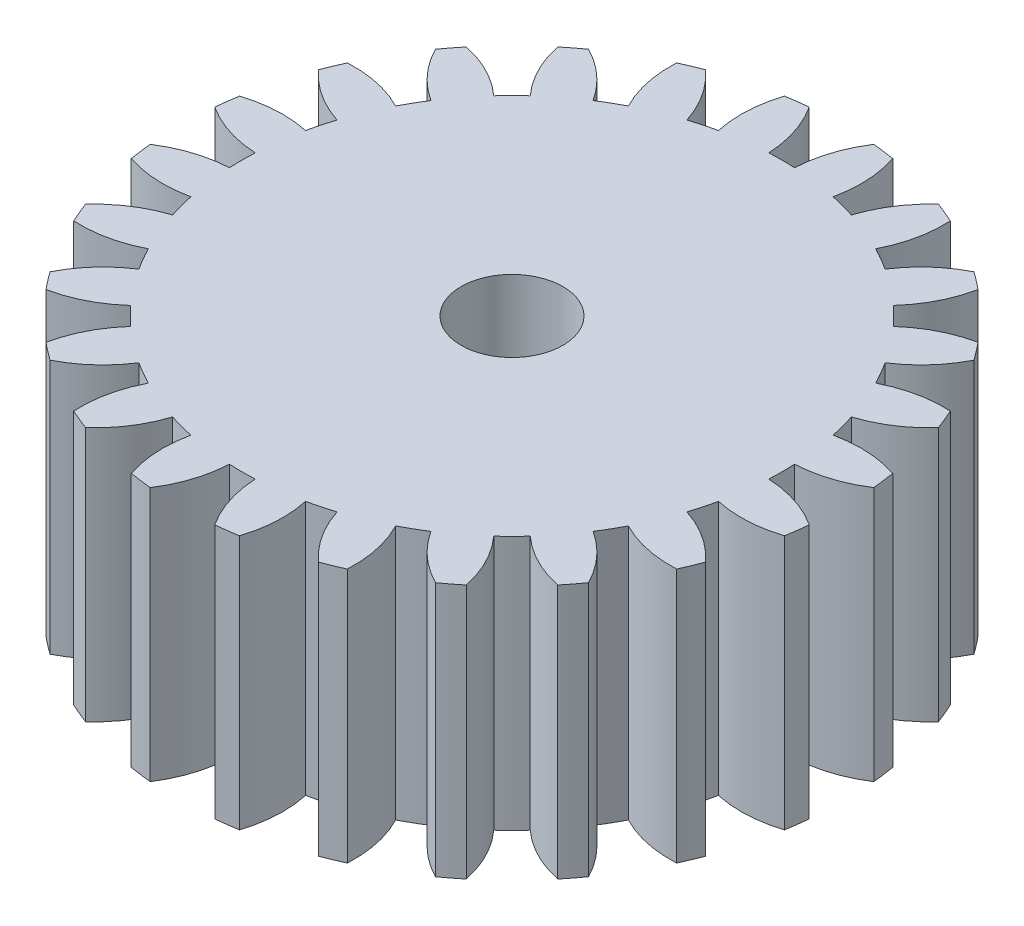
from build123d import *

# Parameters (mm, degrees)
SKETCH1_R               = 6.5
SKETCH1_R_2             = 6
SKETCH1_R_3             = 5.3
BOSS_EXTRUDE1_DEPTH     = 2.5
CUT_EXTRUDE1_DEPTH      = 10.526279442
CIRPATTERN1_COUNT       = 24
CUT_EXTRUDE2_DEPTH      = 10.48407185
CUT_EXTRUDE2_DEPTH_BACK = 10.48407185
SKETCH4_R               = 1


with BuildPart() as part:
    # Sketch1 → Boss-Extrude1 (new, symmetric)
    # profile 1 of 3: a face of its own
    with BuildSketch(Plane(origin=(0, 0, 0), x_dir=(1, 0, 0), z_dir=(0, 1, 0))):
        with Locations(Location((0, 0, 0), (0, 0, 270))):
            Circle(SKETCH1_R)
        Circle(SKETCH1_R_2, mode=Mode.SUBTRACT)
    # profile 2 of 3: a face of its own
    with BuildSketch(Plane(origin=(0, 0, 0), x_dir=(1, 0, 0), z_dir=(0, 1, 0))):
        Circle(SKETCH1_R_2)
        Circle(SKETCH1_R_3, mode=Mode.SUBTRACT)
    # profile 3 of 3: a face of its own
    with BuildSketch(Plane(origin=(0, 0, 0), x_dir=(1, 0, 0), z_dir=(0, 1, 0))):
        Circle(SKETCH1_R_3)
    extrude(amount=BOSS_EXTRUDE1_DEPTH, both=True)

    # Sketch3 → Cut-Extrude1 (cut, symmetric)
    with BuildSketch(Plane(origin=(0, 0, 0), x_dir=(1, 0, 0), z_dir=(0, 1, 0))):
        with BuildLine():
            ThreePointArc((-2.097447593, 7.48155155), (-0.805034356, 6.699886195), (-0.253044756, 5.293955832))
            ThreePointArc((-0.253044756, 5.293955832), (0, 5.3), (0.253044756, 5.293955832))
            ThreePointArc((0.253044756, 5.293955832), (0.805034356, 6.699886195), (2.097447593, 7.48155155))
            ThreePointArc((2.097447593, 7.48155155), (0, 7.77), (-2.097447593, 7.48155155))
        make_face()
    cut_extrude1 = extrude(amount=CUT_EXTRUDE1_DEPTH, both=True, mode=Mode.SUBTRACT)

    # CirPattern1: Cut-Extrude1 ×24 about axis
    cirpattern1_axis = Axis((0, 0, 0), (0, 1, 0))
    for i in range(1, CIRPATTERN1_COUNT):
        add(cut_extrude1.rotate(cirpattern1_axis, i * 360 / CIRPATTERN1_COUNT), mode=Mode.SUBTRACT)

    # Sketch4 → Cut-Extrude2 (cut, two sides: drawn at the far end of the back side and taken through both)
    with BuildSketch(Plane(origin=(0, 0, 0), x_dir=(1, 0, 0), z_dir=(0, 1, 0)).offset(-CUT_EXTRUDE2_DEPTH_BACK)):
        with Locations(Location((0, 0, 0), (0, 0, 270))):
            Circle(SKETCH4_R)
    extrude(amount=CUT_EXTRUDE2_DEPTH + CUT_EXTRUDE2_DEPTH_BACK, mode=Mode.SUBTRACT)


solid = part.part
